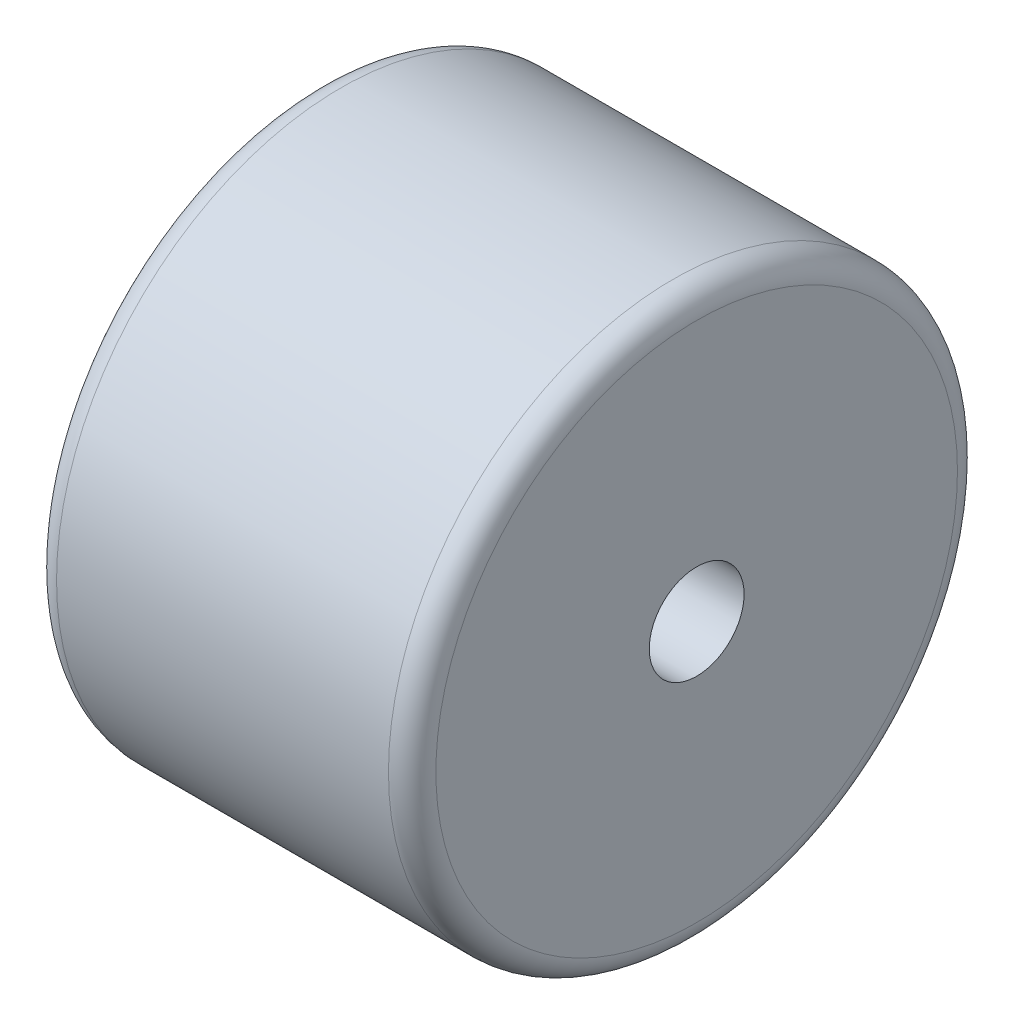
from build123d import *

# Parameters (mm, degrees)
SKETCH1_R           = 9.525
SKETCH1_R_2         = 1.5875
BOSS_EXTRUDE1_DEPTH = 6.35
FILLET1_R           = 0.79375


with BuildPart() as part:
    # Sketch1 → Boss-Extrude1 (new, symmetric)
    with BuildSketch(Plane(origin=(0, 0, 0), x_dir=(0, 0, -1), z_dir=(1, 0, 0))):
        Circle(SKETCH1_R)
        Circle(SKETCH1_R_2, mode=Mode.SUBTRACT)
    extrude(amount=BOSS_EXTRUDE1_DEPTH, both=True)

    # Fillet1
    fillet1_edges = [part.edges().sort_by_distance(p)[0] for p in [
        (-6.35, 0, 9.525),
        (6.35, 0, 9.525),
    ]]
    fillet(fillet1_edges, radius=FILLET1_R)


solid = part.part
